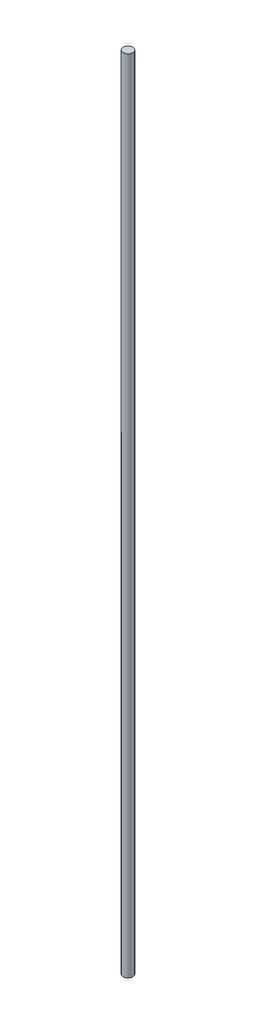
from build123d import *

# Parameters (mm, degrees)
SKETCH_1_R      = 0.6
EXTRUDE_1_DEPTH = 100


with BuildPart() as part:
    # ｽｹｯﾁ1 → ﾎﾞｽ - 押し出し1 (new body)
    with BuildSketch(Plane(origin=(0, 0, 0), x_dir=(1, 0, 0), z_dir=(0, 1, 0))):
        with Locations(Location((0, 0, 0), (0, 0, 270))):
            Circle(SKETCH_1_R)
    extrude(amount=EXTRUDE_1_DEPTH)


solid = part.part
